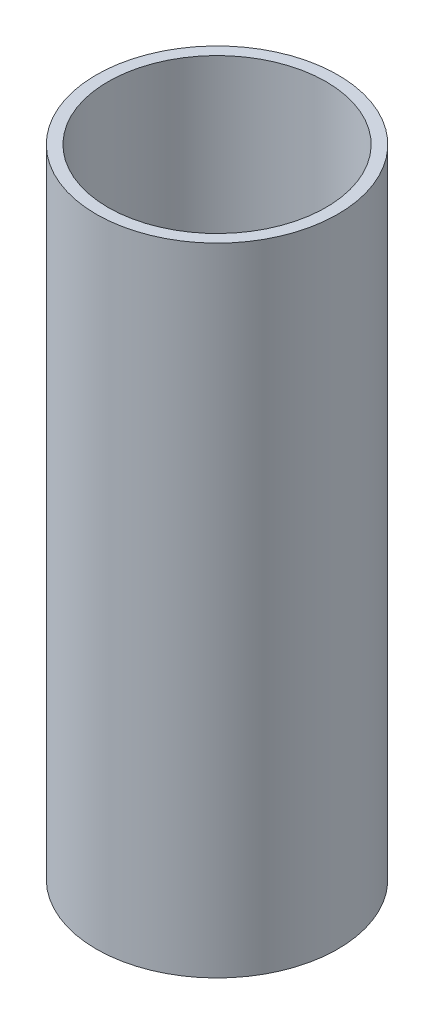
from build123d import *

# Parameters (mm, degrees)
SKETCH1_R           = 19.2786
SKETCH1_R_2         = 17.399
BOSS_EXTRUDE1_DEPTH = 101.6


with BuildPart() as part:
    # Sketch1 → Boss-Extrude1 (new body)
    with BuildSketch(Plane(origin=(0, 0, 0), x_dir=(1, 0, 0), z_dir=(0, 1, 0))):
        with Locations(Location((0, 0, 0), (0, 0, 270))):
            Circle(SKETCH1_R)
        with Locations(Location((0, 0, 0), (0, 0, 270))):
            Circle(SKETCH1_R_2, mode=Mode.SUBTRACT)
    extrude(amount=BOSS_EXTRUDE1_DEPTH)


solid = part.part
